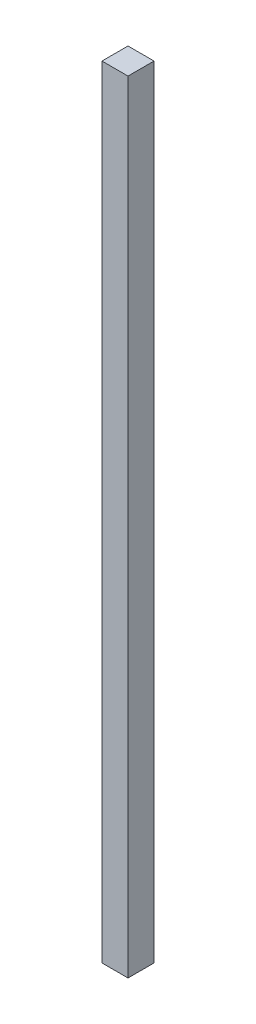
from build123d import *

# Parameters (mm, degrees)
SKETCH_1_W      = 5
SKETCH_1_H      = 5
EXTRUDE_1_DEPTH = 150


with BuildPart() as part:
    # 草图1 → 凸台-拉伸1 (new body)
    with BuildSketch(Plane(origin=(0, 0, 0), x_dir=(1, 0, 0), z_dir=(0, 1, 0))):
        with Locations((2.5, 2.5)):
            Rectangle(SKETCH_1_W, SKETCH_1_H)
    extrude(amount=EXTRUDE_1_DEPTH)


solid = part.part
